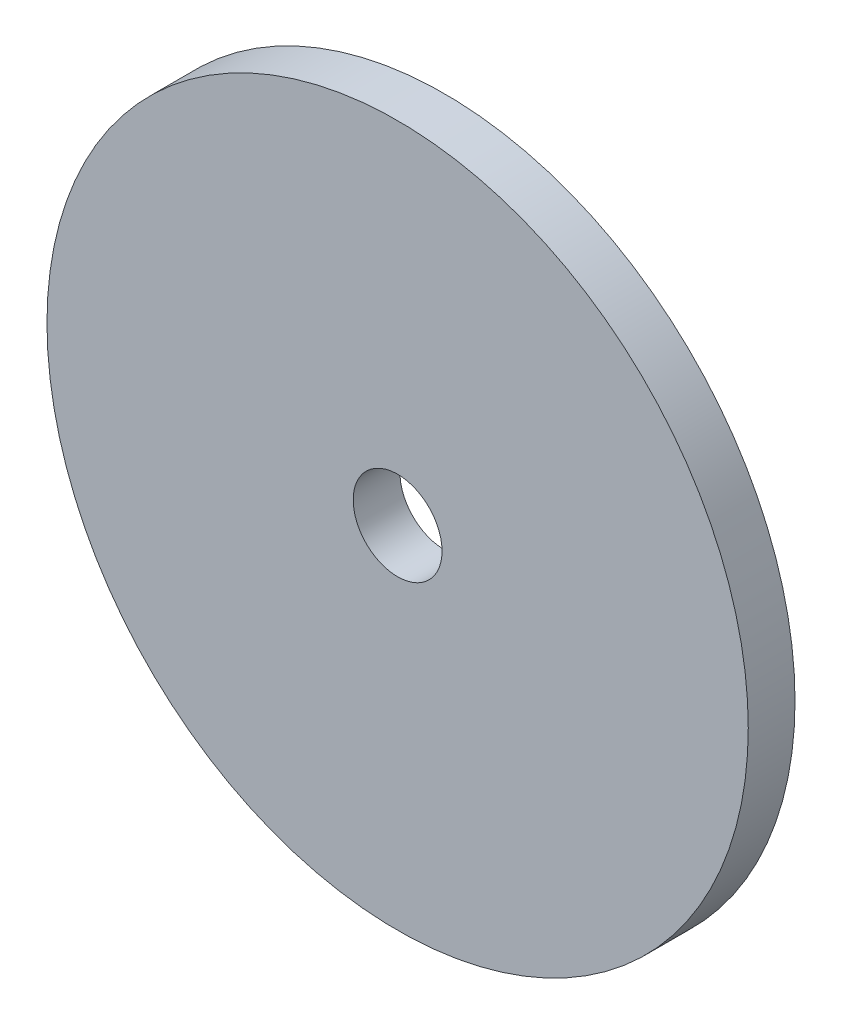
from build123d import *

# Parameters (mm, degrees)
SKETCH_1_R          = 75
EXTRUDE_3_DEPTH     = 10
SKETCH_2_R          = 9.5
CUT_EXTRUDE_1_DEPTH = 10


with BuildPart() as part:
    # 草图1 → 凸台-拉伸3 (new body)
    with BuildSketch(Plane.XY):
        with Locations((-17.46612366, -11.046926923)):
            Circle(SKETCH_1_R)
    extrude(amount=EXTRUDE_3_DEPTH)

    # 草图2 → 切除-拉伸1 (cut)
    with BuildSketch(Plane.XY.offset(10)):
        with Locations((-17.46612366, -11.046926923)):
            Circle(SKETCH_2_R)
    extrude(amount=-CUT_EXTRUDE_1_DEPTH, mode=Mode.SUBTRACT)


solid = part.part
